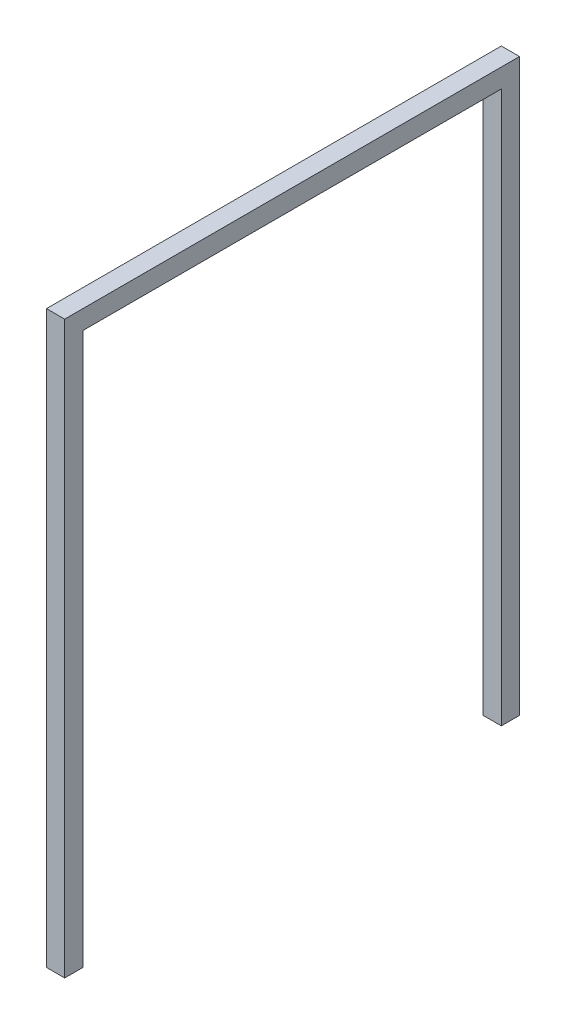
from build123d import *

# Parameters (mm, degrees)
SKETCH2_W             = 24.295652174
SKETCH2_H             = 24.295652174
BOSS_EXTRUDE1_DEPTH   = 762
BOSS_EXTRUDE1_2_DEPTH = 762
SKETCH3_W             = 24.295652174
SKETCH3_H             = 25.4
BOSS_EXTRUDE2_DEPTH   = 558.8


with BuildPart() as part:
    # Sketch2 → Boss-Extrude1 (new body)
    with BuildSketch(Plane(origin=(0, 0, 0), x_dir=(1, 0, 0), z_dir=(0, 1, 0))):
        with Locations((12.147826087, 12.147826087)):
            Rectangle(SKETCH2_W, SKETCH2_H)
    extrude(amount=BOSS_EXTRUDE1_DEPTH)



with BuildPart() as body_2:
    # Sketch2 → Boss-Extrude1 2 (new body)
    with BuildSketch(Plane(origin=(0, 0, 0), x_dir=(1, 0, 0), z_dir=(0, 1, 0))):
        with Locations((12.147826087, 595.243478261)):
            Rectangle(SKETCH2_W, SKETCH2_H)
    extrude(amount=BOSS_EXTRUDE1_2_DEPTH)


with BuildPart() as part_1:
    add(part.part)

    add(body_2.part)  # Boss-Extrude2 merges body 2
    # Sketch3 → Boss-Extrude2 (add)
    with BuildSketch(Plane.XY.offset(-583.095652174)):
        with Locations((12.147826087, 749.3)):
            Rectangle(SKETCH3_W, SKETCH3_H)
    extrude(amount=BOSS_EXTRUDE2_DEPTH)


solid = part_1.part
